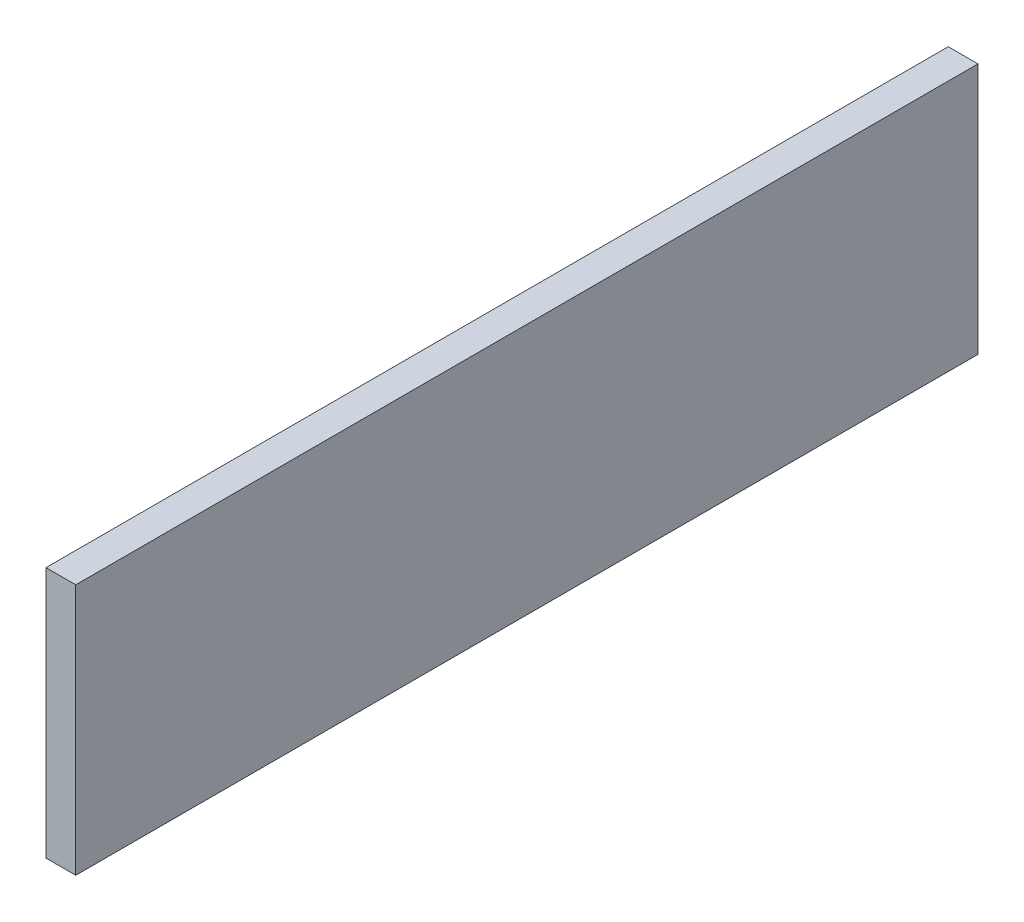
from build123d import *

# Parameters (mm, degrees)
SKETCH1_W           = 76.2
SKETCH1_H           = 2311.4
BOSS_EXTRUDE1_DEPTH = 644.525


with BuildPart() as part:
    # Sketch1 → Boss-Extrude1 (new body)
    with BuildSketch(Plane(origin=(0, 0, 0), x_dir=(1, 0, 0), z_dir=(0, 1, 0))):
        with Locations((38.1, 1155.7)):
            Rectangle(SKETCH1_W, SKETCH1_H)
    extrude(amount=BOSS_EXTRUDE1_DEPTH)


solid = part.part
